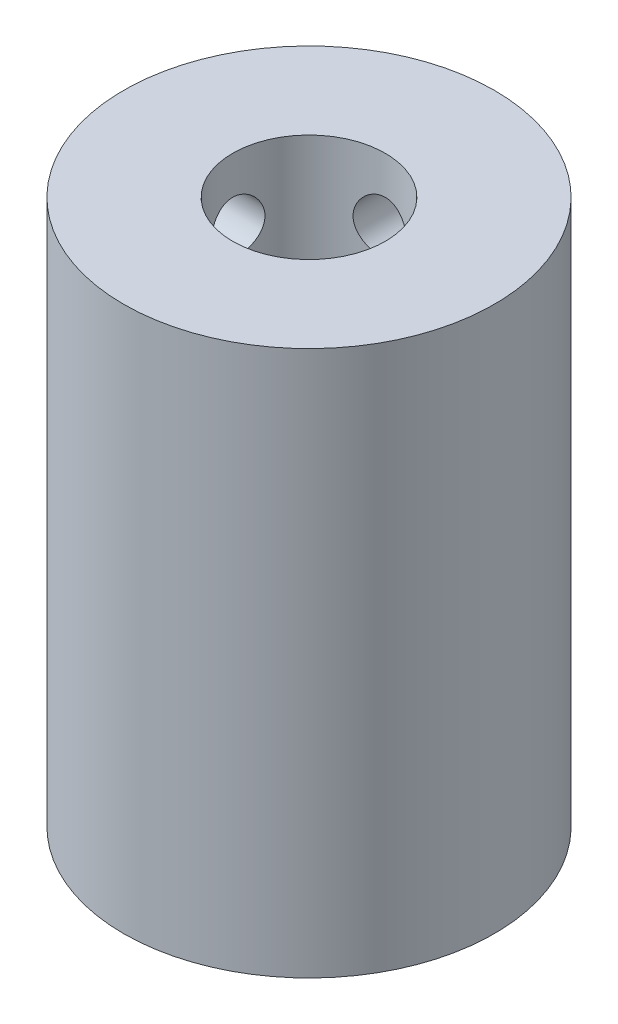
from build123d import *

# Parameters (mm, degrees)
SKETCH1_R           = 17
SKETCH1_R_2         = 7
BOSS_EXTRUDE1_DEPTH = 50
SKETCH2_R           = 2.5
CUT_EXTRUDE1_DEPTH  = 56.479726027
SKETCH3_R           = 2.5
CUT_EXTRUDE2_DEPTH  = 56.479726178


with BuildPart() as part:
    # Sketch1 → Boss-Extrude1 (new body)
    with BuildSketch(Plane(origin=(0, 0, 0), x_dir=(1, 0, 0), z_dir=(0, 1, 0))):
        with Locations(Location((0, 0, 0), (0, 0, 270))):
            Circle(SKETCH1_R)
        with Locations(Location((0, 0, 0), (0, 0, 270))):
            Circle(SKETCH1_R_2, mode=Mode.SUBTRACT)
    extrude(amount=BOSS_EXTRUDE1_DEPTH)

    # Sketch2 → Cut-Extrude1 (cut, through all)
    with BuildSketch(Plane.XY):
        with Locations(Location((0, 44, 0), (0, 0, 90))):
            Circle(SKETCH2_R)
        with Locations(Location((0, 6, 0), (0, 0, 90))):
            Circle(SKETCH2_R)
    extrude(amount=-CUT_EXTRUDE1_DEPTH, mode=Mode.SUBTRACT)

    # Sketch3 → Cut-Extrude2 (cut, through all)
    with BuildSketch(Plane(origin=(0, 0, 0), x_dir=(0, 0, -1), z_dir=(1, 0, 0))):
        with Locations((0, 44)):
            Circle(SKETCH3_R)
        with Locations((0, 6)):
            Circle(SKETCH3_R)
    extrude(amount=-CUT_EXTRUDE2_DEPTH, mode=Mode.SUBTRACT)


solid = part.part
